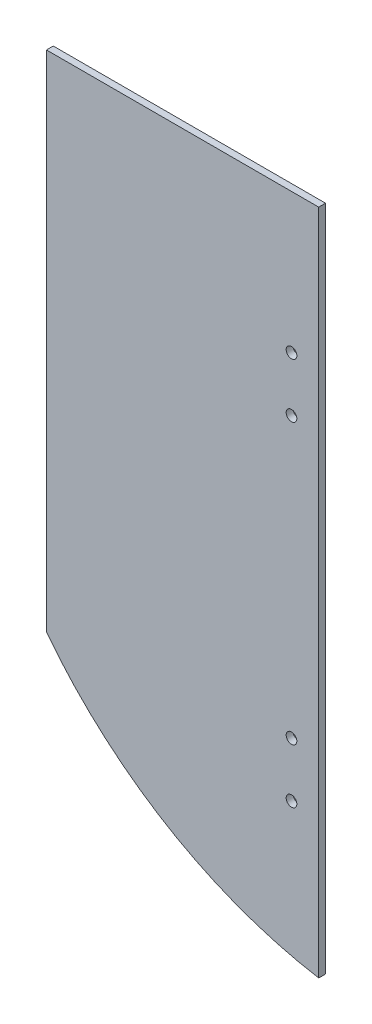
from build123d import *

# Parameters (mm, degrees)
SKETCH1_W                  = 311.404
SKETCH1_H                  = 127
BOSS_EXTRUDE1_DEPTH        = 3.175
F_9_0_196_DIAMETER_HOLE1_D = 4.9784
CUT_EXTRUDE1_DEPTH         = 169.182767931


with BuildPart() as part:
    # Sketch1 → Boss-Extrude1 (new body)
    with BuildSketch(Plane(origin=(0, 0, 0), x_dir=(0, 1, 0), z_dir=(0, 0, 1))):
        Rectangle(SKETCH1_W, SKETCH1_H)
    extrude(amount=BOSS_EXTRUDE1_DEPTH)

    # #9 (0.196) Diameter Hole1 (through all)
    with Locations(Plane.XY.offset(3.175)):
        with Locations((50.8, 90.551), (50.8, -90.551), (50.8, -65.151), (50.8, 65.151)):
            Hole(F_9_0_196_DIAMETER_HOLE1_D / 2)

    # Sketch4 → Cut-Extrude1 (cut, through all)
    with BuildSketch(Plane.XY.offset(3.175)):
        with BuildLine():
            Line((-63.5, -79.502), (-63.5, -155.702))
            Line((-63.5, -155.702), (63.5, -155.702))
            ThreePointArc((63.5, -155.702), (-7.189698378, -129.58483063), (-63.5, -79.502))
        make_face()
    extrude(amount=-CUT_EXTRUDE1_DEPTH, mode=Mode.SUBTRACT)


solid = part.part
